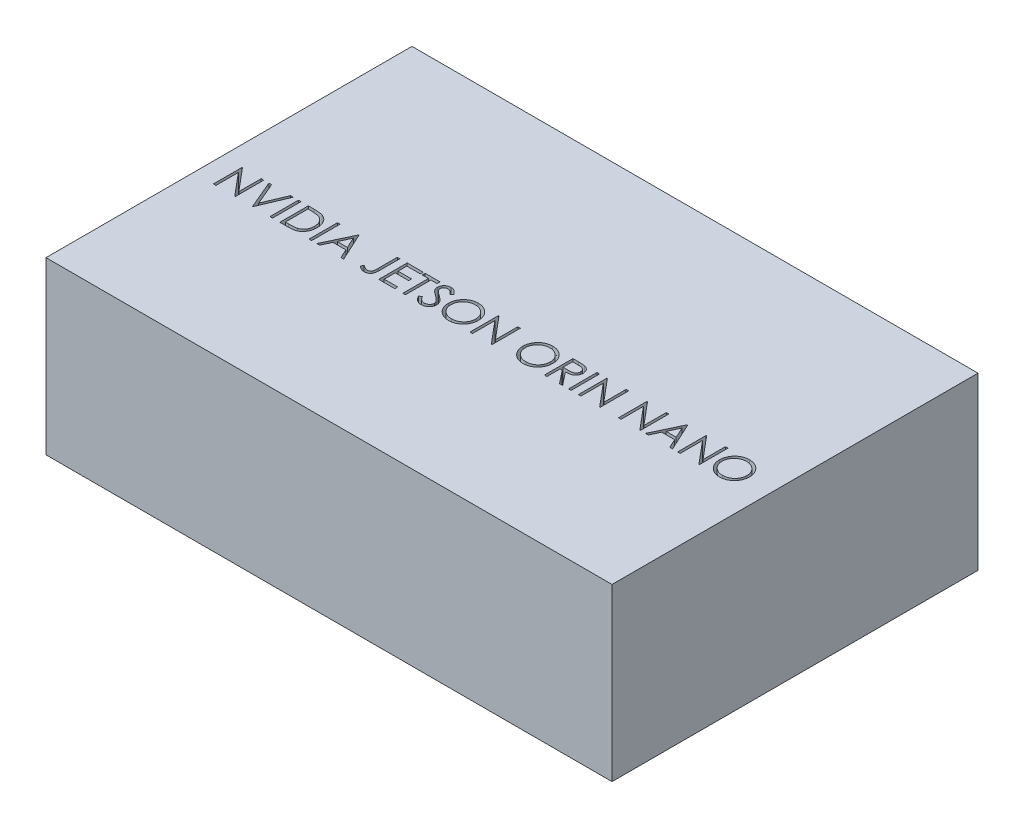
from build123d import *

# Parameters (mm, degrees)
SKETCH1_W           = 69.6
SKETCH1_H           = 45
BOSS_EXTRUDE1_DEPTH = 21
SKETCH2_W           = 0.314102564
SKETCH2_H           = 3.5
CUT_EXTRUDE1_DEPTH  = 10


with BuildPart() as part:
    # Sketch1 → Boss-Extrude1 (new body)
    with BuildSketch(Plane(origin=(0, 0, 0), x_dir=(1, 0, 0), z_dir=(0, 1, 0))):
        with Locations((34.8, 22.5)):
            Rectangle(SKETCH1_W, SKETCH1_H)
    extrude(amount=BOSS_EXTRUDE1_DEPTH)

    # Sketch2 → Cut-Extrude1 (cut)
    # profile 1 of 20: a face of its own
    with BuildSketch(Plane(origin=(0, 21, 0), x_dir=(1, 0, 0), z_dir=(0, 1, 0))):
        Polygon((2.444579456, 18.144195519), (2.444579456, 21.644195519), (2.510484905, 21.644195519), (4.822784584, 18.889487987), (4.822784584, 21.644195519), (5.136887148, 21.644195519), (5.136887148, 18.144195519), (5.065372725, 18.144195519), (2.75868202, 20.892592955), (2.75868202, 18.144195519), align=None)
    # profile 2 of 20: a face of its own
    with BuildSketch(Plane(origin=(0, 21, 0), x_dir=(1, 0, 0), z_dir=(0, 1, 0))):
        Polygon((5.765092276, 21.644195519), (6.101630738, 21.644195519), (7.268297405, 18.885982378), (8.434964071, 21.644195519), (8.771502533, 21.644195519), (7.290733302, 18.144195519), (7.245861507, 18.144195519), align=None)
    # profile 3 of 20: a face of its own
    with BuildSketch(Plane(origin=(0, 21, 0), x_dir=(1, 0, 0), z_dir=(0, 1, 0))):
        with Locations((9.556758943, 19.894195519)):
            Rectangle(SKETCH2_W, SKETCH2_H)
    # profile 4 of 20: a face of its own
    with BuildSketch(Plane(origin=(0, 21, 0), x_dir=(1, 0, 0), z_dir=(0, 1, 0))):
        with BuildLine():
            Line((10.611246123, 18.144195519), (10.611246123, 21.644195519))
            Line((10.611246123, 21.644195519), (11.317976892, 21.644195519))
            add(Edge.make_bspline(
                [(11.317976892, 21.644195519), (11.37944588, 21.643752949), (11.498203645, 21.642897906), (11.669816093, 21.637476515), (11.828599855, 21.627886049), (11.974032714, 21.613916523), (12.106513926, 21.59676349), (12.225672534, 21.575263085), (12.332124677, 21.549874915), (12.397594118, 21.528229465), (12.428553815, 21.517993596)],
                knots=[0, 0, 0, 0, 1.314313732, 2.53924729, 3.670748893, 4.714932338, 5.66265055, 6.526160246, 7.303039223, 8, 8, 8, 8], degree=3))
            add(Edge.make_bspline(
                [(12.428553815, 21.517993596), (12.469048554, 21.502562891), (12.549119746, 21.472051397), (12.663126869, 21.414495095), (12.770452232, 21.349281993), (12.871671377, 21.276326131), (12.964472203, 21.193561782), (13.0524801, 21.104504697), (13.132094824, 21.005916356), (13.20500312, 20.899841368), (13.270738779, 20.787529316), (13.327877937, 20.669194208), (13.37533193, 20.545436999), (13.414725157, 20.416601852), (13.445771615, 20.282405474), (13.466953546, 20.142691608), (13.480924536, 19.998012418), (13.482328587, 19.899837955), (13.483040994, 19.850024846)],
                knots=[0, 0, 0, 0, 0.984719456, 1.947108742, 2.898477687, 3.838006223, 4.779231079, 5.722358779, 6.681677486, 7.655904652, 8.64651281, 9.637519902, 10.640069247, 11.656948941, 12.698408672, 13.768548281, 14.867775369, 16, 16, 16, 16], degree=3))
            add(Edge.make_bspline(
                [(13.483040994, 19.850024846), (13.482412027, 19.806763608), (13.481172581, 19.721512819), (13.470043265, 19.595871923), (13.453866945, 19.473958352), (13.428822747, 19.356352652), (13.398420234, 19.242024434), (13.359456082, 19.13219219), (13.314820586, 19.02584838), (13.262770708, 18.924430904), (13.205629322, 18.828347532), (13.144307579, 18.737772004), (13.078870884, 18.653996782), (13.008695251, 18.57676817), (12.934687535, 18.506202592), (12.856363204, 18.441710576), (12.773520153, 18.384554021), (12.68652943, 18.332486913), (12.592853301, 18.287066558), (12.490717435, 18.248636548), (12.379686257, 18.216789933), (12.2600323, 18.190219037), (12.131548822, 18.169141734), (11.994109857, 18.155015342), (11.847926567, 18.145462409), (11.747547302, 18.144626016), (11.695881539, 18.144195519)],
                knots=[0, 0, 0, 0, 1.105936401, 2.179363191, 3.223086493, 4.248585256, 5.251745608, 6.245858792, 7.225916811, 8.198733463, 9.158002045, 10.082870192, 10.993790845, 11.873723703, 12.748670949, 13.606408763, 14.465103618, 15.319838547, 16.196477973, 17.123216899, 18.106603292, 19.147568657, 20.255746949, 21.433717677, 22.679120308, 24, 24, 24, 24], degree=3))
            Line((11.695881539, 18.144195519), (10.611246123, 18.144195519))
        make_face()
        with BuildLine():
            Line((10.925348687, 18.503169878), (11.327091475, 18.503169878))
            add(Edge.make_bspline(
                [(11.327091475, 18.503169878), (11.384819846, 18.503417975), (11.495852644, 18.503895155), (11.655510642, 18.508082358), (11.801390038, 18.514924296), (11.933511547, 18.524499373), (12.051800572, 18.537167989), (12.156504322, 18.551292891), (12.24727958, 18.568890342), (12.302209017, 18.584841301), (12.327592276, 18.592212346)],
                knots=[0, 0, 0, 0, 1.375205317, 2.645023457, 3.804390687, 4.853969522, 5.800190428, 6.637939096, 7.370582563, 8, 8, 8, 8], degree=3))
            add(Edge.make_bspline(
                [(12.327592276, 18.592212346), (12.359540638, 18.603463905), (12.422674277, 18.625698278), (12.513555362, 18.666255939), (12.598312366, 18.714298009), (12.678422392, 18.767700283), (12.752749047, 18.828346285), (12.822173164, 18.894917274), (12.886554965, 18.967752049), (12.945229273, 19.04676021), (12.997737577, 19.131450006), (13.043208806, 19.220988839), (13.083060338, 19.31439565), (13.114338931, 19.413104808), (13.138854515, 19.516233867), (13.156219203, 19.62379008), (13.167033927, 19.735753362), (13.168295375, 19.811905486), (13.16893843, 19.850725968)],
                knots=[0, 0, 0, 0, 0.998632004, 1.973411704, 2.929992603, 3.868527914, 4.809262121, 5.754881198, 6.702106254, 7.672490631, 8.653608572, 9.636854334, 10.631411391, 11.644891563, 12.686317036, 13.754757253, 14.855430412, 16, 16, 16, 16], degree=3))
            add(Edge.make_bspline(
                [(13.16893843, 19.850725968), (13.168425143, 19.891659448), (13.167416785, 19.972073633), (13.154742475, 20.090064328), (13.136220919, 20.203544979), (13.109437233, 20.312523174), (13.075306354, 20.417211526), (13.032711713, 20.517031036), (12.984045093, 20.613035905), (12.926141757, 20.703010271), (12.862726163, 20.78810338), (12.792348284, 20.866058296), (12.716126245, 20.937052596), (12.634891396, 21.002191909), (12.546354297, 21.058855584), (12.452600606, 21.109542266), (12.352254935, 21.152558157), (12.282442239, 21.17543702), (12.24696327, 21.187064109)],
                knots=[0, 0, 0, 0, 1.122418816, 2.205001699, 3.251619955, 4.274784885, 5.280384055, 6.268708349, 7.249350384, 8.229342522, 9.199999885, 10.157847722, 11.105861043, 12.055065948, 13.010012805, 13.98527497, 14.976112212, 16, 16, 16, 16], degree=3))
            add(Edge.make_bspline(
                [(12.24696327, 21.187064109), (12.217612124, 21.195180537), (12.155203533, 21.21243829), (12.053364069, 21.231263662), (11.93874892, 21.247868161), (11.810849219, 21.2619262), (11.66981076, 21.272013522), (11.515525072, 21.279584836), (11.347925467, 21.284691469), (11.231742933, 21.285040176), (11.171442437, 21.28522116)],
                knots=[0, 0, 0, 0, 0.674548936, 1.434276114, 2.292660221, 3.240891867, 4.284742987, 5.42552168, 6.663806718, 8, 8, 8, 8], degree=3))
            Line((11.171442437, 21.28522116), (10.925348687, 21.28522116))
            Line((10.925348687, 21.28522116), (10.925348687, 18.503169878))
        make_face(mode=Mode.SUBTRACT)
    # profile 5 of 20: a face of its own
    with BuildSketch(Plane(origin=(0, 21, 0), x_dir=(1, 0, 0), z_dir=(0, 1, 0))):
        with Locations((14.358040994, 19.894195519)):
            Rectangle(SKETCH2_W, SKETCH2_H)
    # profile 6 of 20: a face of its own
    with BuildSketch(Plane(origin=(0, 21, 0), x_dir=(1, 0, 0), z_dir=(0, 1, 0))):
        Polygon((16.84842561, 21.644195519), (18.463810225, 18.144195519), (18.122363911, 18.144195519), (17.604936026, 19.265990391), (16.018297405, 19.265990391), (15.486145962, 18.144195519), (15.143297405, 18.144195519), (16.803553815, 21.644195519), align=None)
        Polygon((16.822484103, 20.962004013), (16.188670001, 19.62496475), (17.439471283, 19.62496475), align=None, mode=Mode.SUBTRACT)
    # profile 7 of 20: a face of its own
    with BuildSketch(Plane(origin=(0, 21, 0), x_dir=(1, 0, 0), z_dir=(0, 1, 0))):
        with BuildLine():
            Line((21.559964071, 21.644195519), (21.874066635, 21.644195519))
            Line((21.874066635, 21.644195519), (21.874066635, 19.280713949))
            add(Edge.make_bspline(
                [(21.874066635, 19.280713949), (21.873752717, 19.237008778), (21.873149955, 19.153089517), (21.869835544, 19.032215621), (21.863702066, 18.921844935), (21.854767054, 18.821726488), (21.842846821, 18.732173932), (21.829205793, 18.652495315), (21.812692994, 18.583355632), (21.787826528, 18.505720276), (21.747052579, 18.420576472), (21.685685541, 18.328621321), (21.609452745, 18.24818791), (21.521151711, 18.178335186), (21.420010687, 18.122677954), (21.308112468, 18.082722776), (21.186145881, 18.058351919), (21.101546668, 18.055778014), (21.057960866, 18.05445193)],
                knots=[0, 0, 0, 0, 1.237770943, 2.376671248, 3.424123796, 4.367912054, 5.222547132, 5.982086412, 6.656319012, 7.234008312, 8.288027371, 9.317870876, 10.352700517, 11.413286737, 12.494591526, 13.606319346, 14.766767577, 16, 16, 16, 16], degree=3))
            add(Edge.make_bspline(
                [(21.057960866, 18.05445193), (21.024002508, 18.055532539), (20.955676042, 18.057706796), (20.853985333, 18.075428509), (20.752583357, 18.102744552), (20.650931908, 18.142747148), (20.547022667, 18.197152746), (20.43944832, 18.268337563), (20.326825129, 18.356169089), (20.252641843, 18.423206835), (20.213810225, 18.458298083)],
                knots=[0, 0, 0, 0, 0.848567217, 1.707373443, 2.573483905, 3.470863513, 4.432650262, 5.500696352, 6.691726801, 8, 8, 8, 8], degree=3))
            Line((20.213810225, 18.458298083), (20.398906379, 18.727528853))
            add(Edge.make_bspline(
                [(20.398906379, 18.727528853), (20.441609058, 18.698081456), (20.522237284, 18.642480933), (20.640741725, 18.570954332), (20.745738878, 18.509629167), (20.814421825, 18.478376888), (20.846222084, 18.463907058)],
                knots=[0, 0, 0, 0, 1.196737151, 2.259595785, 3.194191475, 4, 4, 4, 4], degree=3))
            add(Edge.make_bspline(
                [(20.846222084, 18.463907058), (20.865506396, 18.4563476), (20.903327225, 18.441521821), (20.961152305, 18.424975923), (21.018647341, 18.415933513), (21.056765035, 18.41425218), (21.075488911, 18.413426289)],
                knots=[0, 0, 0, 0, 1.051806502, 2.062826769, 3.048436908, 4, 4, 4, 4], degree=3))
            add(Edge.make_bspline(
                [(21.075488911, 18.413426289), (21.099671699, 18.414449024), (21.147472156, 18.416470593), (21.21693615, 18.434319869), (21.283394181, 18.461564272), (21.344463839, 18.501455565), (21.400749226, 18.548886986), (21.447192051, 18.606242995), (21.485909296, 18.669808979), (21.509208989, 18.729980433), (21.524053761, 18.784857063), (21.533475388, 18.835290199), (21.541714048, 18.894251677), (21.5488956, 18.961811878), (21.553100071, 19.03810606), (21.557817344, 19.122910203), (21.559522605, 19.216438115), (21.559812425, 19.281649067), (21.559964071, 19.315770039)],
                knots=[0, 0, 0, 0, 0.997221856, 1.971139923, 2.944579524, 3.951425367, 4.971190333, 5.972282193, 6.985401279, 8.033996657, 8.624075553, 9.332086008, 10.151144245, 11.082816738, 12.137127781, 13.306538797, 14.590673636, 16, 16, 16, 16], degree=3))
            Line((21.559964071, 19.315770039), (21.559964071, 21.644195519))
        make_face()
    # profile 8 of 20: a face of its own
    with BuildSketch(Plane(origin=(0, 21, 0), x_dir=(1, 0, 0), z_dir=(0, 1, 0))):
        Polygon((22.771502533, 21.644195519), (24.745861507, 21.644195519), (24.745861507, 21.28522116), (23.085605097, 21.28522116), (23.085605097, 20.208298083), (24.745861507, 20.208298083), (24.745861507, 19.849323724), (23.085605097, 19.849323724), (23.085605097, 18.503169878), (24.745861507, 18.503169878), (24.745861507, 18.144195519), (22.771502533, 18.144195519), align=None)
    # profile 9 of 20: a face of its own
    with BuildSketch(Plane(origin=(0, 21, 0), x_dir=(1, 0, 0), z_dir=(0, 1, 0))):
        Polygon((24.970220481, 21.28522116), (24.970220481, 21.644195519), (26.809964071, 21.644195519), (26.809964071, 21.28522116), (26.047143558, 21.28522116), (26.047143558, 18.144195519), (25.733040994, 18.144195519), (25.733040994, 21.28522116), align=None)
    # profile 10 of 20: a face of its own
    with BuildSketch(Plane(origin=(0, 21, 0), x_dir=(1, 0, 0), z_dir=(0, 1, 0))):
        with BuildLine():
            Line((26.989451251, 18.819375808), (27.285324648, 18.996759622))
            add(Edge.make_bspline(
                [(27.285324648, 18.996759622), (27.312842885, 18.950695237), (27.365566766, 18.862437653), (27.453518125, 18.743179613), (27.544651036, 18.641817456), (27.63964037, 18.558940848), (27.737906318, 18.493691962), (27.840090372, 18.44748973), (27.945848182, 18.418673754), (28.017822004, 18.415173668), (28.053754135, 18.413426289)],
                knots=[0, 0, 0, 0, 1.272034388, 2.437168799, 3.508375237, 4.49857839, 5.41946034, 6.295179144, 7.148887113, 8, 8, 8, 8], degree=3))
            add(Edge.make_bspline(
                [(28.053754135, 18.413426289), (28.084440996, 18.414280961), (28.145277769, 18.415975351), (28.234840012, 18.432256153), (28.321821814, 18.457268282), (28.404430452, 18.493089214), (28.481526066, 18.5364277), (28.549132762, 18.588773877), (28.607578875, 18.647380083), (28.655387989, 18.712762737), (28.692068025, 18.783079886), (28.720260093, 18.855255837), (28.735905167, 18.930424406), (28.73826192, 18.981034868), (28.739451251, 19.006575327)],
                knots=[0, 0, 0, 0, 1.095163259, 2.171163733, 3.241058638, 4.321873601, 5.38011039, 6.391990106, 7.366004449, 8.327778327, 9.272591725, 10.192022065, 11.087607919, 12, 12, 12, 12], degree=3))
            add(Edge.make_bspline(
                [(28.739451251, 19.006575327), (28.73797694, 19.035716177), (28.734979882, 19.094955266), (28.709648402, 19.182354919), (28.669799155, 19.268847489), (28.633036511, 19.322348754), (28.613950449, 19.350125007)],
                knots=[0, 0, 0, 0, 0.938893495, 1.908633276, 2.914225137, 4, 4, 4, 4], degree=3))
            add(Edge.make_bspline(
                [(28.613950449, 19.350125007), (28.598279835, 19.37017183), (28.565381341, 19.412257629), (28.508823828, 19.474902864), (28.442457714, 19.539521283), (28.368554159, 19.60858034), (28.28442107, 19.678868137), (28.192693556, 19.753736415), (28.091029697, 19.830337992), (28.0197302, 19.881710557), (27.982940834, 19.908217955)],
                knots=[0, 0, 0, 0, 0.722233717, 1.516239348, 2.393582979, 3.351407094, 4.387010283, 5.505090956, 6.712668013, 8, 8, 8, 8], degree=3))
            add(Edge.make_bspline(
                [(27.982940834, 19.908217955), (27.946116838, 19.934446543), (27.875712161, 19.984593605), (27.777253579, 20.059017889), (27.689209116, 20.127061759), (27.611970099, 20.189365771), (27.545570503, 20.245938375), (27.489487092, 20.296236315), (27.445148534, 20.341619876), (27.420492954, 20.371061217), (27.409423206, 20.384279654)],
                knots=[0, 0, 0, 0, 1.452282411, 2.77665338, 3.964542531, 5.026858415, 5.96415736, 6.766646006, 7.446254459, 8, 8, 8, 8], degree=3))
            add(Edge.make_bspline(
                [(27.409423206, 20.384279654), (27.393950661, 20.404880691), (27.363521824, 20.445395395), (27.323355818, 20.508720252), (27.289216656, 20.573543518), (27.262454324, 20.640039382), (27.239918105, 20.707274311), (27.224760174, 20.776125557), (27.215268777, 20.846284175), (27.21429679, 20.893497676), (27.213810225, 20.917132218)],
                knots=[0, 0, 0, 0, 1.068054152, 2.10047183, 3.106115577, 4.101338837, 5.06977816, 6.043150881, 7.020423561, 8, 8, 8, 8], degree=3))
            add(Edge.make_bspline(
                [(27.213810225, 20.917132218), (27.215115434, 20.954161993), (27.217697954, 21.027430056), (27.239538471, 21.134460887), (27.274011365, 21.236647304), (27.322306253, 21.332977638), (27.384563606, 21.420943619), (27.45660958, 21.501557106), (27.542421066, 21.569325688), (27.63657369, 21.628537746), (27.739630062, 21.674883671), (27.847620965, 21.709844652), (27.960718037, 21.729653909), (28.037321172, 21.732496674), (28.076190033, 21.733939109)],
                knots=[0, 0, 0, 0, 1.005424448, 1.989358655, 2.955360095, 3.929531133, 4.905563448, 5.876582895, 6.856512386, 7.866279853, 8.892233794, 9.918561126, 10.94386622, 12, 12, 12, 12], degree=3))
            add(Edge.make_bspline(
                [(28.076190033, 21.733939109), (28.117434133, 21.732516557), (28.199455485, 21.729687556), (28.3201047, 21.705090025), (28.436265417, 21.664389353), (28.529708682, 21.618200695), (28.602841443, 21.57206928), (28.658614176, 21.530049455), (28.715131627, 21.481674347), (28.772849681, 21.426815101), (28.830790341, 21.36496835), (28.889813793, 21.296557661), (28.950058062, 21.222001105), (28.988813922, 21.168776604), (29.00868202, 21.141491192)],
                knots=[0, 0, 0, 0, 1.286793592, 2.559021753, 3.825965368, 5.121522368, 5.803751409, 6.523245864, 7.299691795, 8.125521123, 9.008227632, 9.944561021, 10.946284179, 12, 12, 12, 12], degree=3))
            Line((29.00868202, 21.141491192), (28.724727693, 20.926246801))
            add(Edge.make_bspline(
                [(28.724727693, 20.926246801), (28.707581761, 20.948335492), (28.674562703, 20.990873145), (28.624433217, 21.050444461), (28.577184569, 21.10486094), (28.530634169, 21.152126068), (28.487240537, 21.194828202), (28.445123495, 21.231387958), (28.404889144, 21.262163554), (28.354172233, 21.295007114), (28.290454515, 21.327563617), (28.210469979, 21.355112695), (28.126883704, 21.371667757), (28.069954072, 21.373856645), (28.041133943, 21.37496475)],
                knots=[0, 0, 0, 0, 1.181633172, 2.275549214, 3.290209073, 4.226197932, 5.078386478, 5.862611352, 6.581680152, 7.217281963, 8.414376989, 9.595101626, 10.782541182, 12, 12, 12, 12], degree=3))
            add(Edge.make_bspline(
                [(28.041133943, 21.37496475), (28.004977421, 21.37375305), (27.935252973, 21.371416401), (27.836262737, 21.345896416), (27.747168812, 21.305714555), (27.670616247, 21.249399577), (27.60687927, 21.182678585), (27.560773811, 21.10589973), (27.533023647, 21.021117327), (27.529637367, 20.961975671), (27.527912789, 20.931855776)],
                knots=[0, 0, 0, 0, 1.14458467, 2.207223713, 3.21896685, 4.227309161, 5.202851033, 6.127160689, 7.046193047, 8, 8, 8, 8], degree=3))
            add(Edge.make_bspline(
                [(27.527912789, 20.931855776), (27.528305916, 20.913104297), (27.529092812, 20.875570678), (27.54006761, 20.820119256), (27.554166939, 20.764807916), (27.57650957, 20.709885334), (27.607354874, 20.654390975), (27.64786005, 20.597369237), (27.698873362, 20.538317528), (27.737950374, 20.499910155), (27.75858186, 20.479632218)],
                knots=[0, 0, 0, 0, 0.858281714, 1.717966888, 2.583508476, 3.4729293, 4.427298488, 5.488583878, 6.674047936, 8, 8, 8, 8], degree=3))
            add(Edge.make_bspline(
                [(27.75858186, 20.479632218), (27.766243232, 20.472795192), (27.784444899, 20.456551984), (27.817720825, 20.429959703), (27.861663623, 20.397156931), (27.915125824, 20.356569615), (27.979093186, 20.309488152), (28.053572742, 20.25651454), (28.137734275, 20.195929081), (28.197456191, 20.153571541), (28.229034584, 20.131174686)],
                knots=[0, 0, 0, 0, 0.420754252, 0.999615792, 1.744751191, 2.668019286, 3.750313428, 4.999500688, 6.413464383, 8, 8, 8, 8], degree=3))
            add(Edge.make_bspline(
                [(28.229034584, 20.131174686), (28.267020497, 20.103533326), (28.340574954, 20.050009665), (28.445232534, 19.969593985), (28.540126342, 19.890946216), (28.625589545, 19.814568609), (28.702466454, 19.741040516), (28.769904174, 19.669477336), (28.828589855, 19.600391763), (28.891769073, 19.511819187), (28.956326893, 19.403038103), (29.0117684, 19.269759864), (29.046726748, 19.135963544), (29.051298263, 19.046036708), (29.053553815, 19.001667474)],
                knots=[0, 0, 0, 0, 1.163667725, 2.253281268, 3.268753668, 4.215851969, 5.092017293, 5.902905408, 6.650798638, 7.335211899, 8.59617414, 9.77448103, 10.901945474, 12, 12, 12, 12], degree=3))
            add(Edge.make_bspline(
                [(29.053553815, 19.001667474), (29.052896677, 18.970289109), (29.051595162, 18.908141726), (29.036634248, 18.816886649), (29.014714583, 18.728255779), (28.981677349, 18.643344667), (28.94135419, 18.560599904), (28.890187943, 18.482192004), (28.830880258, 18.406385605), (28.762846493, 18.335202114), (28.688400591, 18.269855918), (28.609716896, 18.211726856), (28.526666623, 18.163258533), (28.439700306, 18.123707691), (28.34879797, 18.092774173), (28.253990186, 18.070361304), (28.155120675, 18.056605593), (28.087920193, 18.055177832), (28.053754135, 18.05445193)],
                knots=[0, 0, 0, 0, 0.983748083, 1.948392443, 2.894712957, 3.844097841, 4.80183111, 5.778335162, 6.776009319, 7.81870978, 8.863265674, 9.881300176, 10.883814829, 11.87499822, 12.874611388, 13.892143829, 14.928324115, 16, 16, 16, 16], degree=3))
            add(Edge.make_bspline(
                [(28.053754135, 18.05445193), (28.027318792, 18.054963111), (27.974781032, 18.055979037), (27.89707155, 18.064960317), (27.820931961, 18.077667421), (27.747317679, 18.097841491), (27.675280268, 18.122318468), (27.605133033, 18.1524568), (27.536841979, 18.188574002), (27.470024396, 18.229869026), (27.404850222, 18.277926771), (27.341930754, 18.333900267), (27.279201568, 18.396245772), (27.218514172, 18.466656336), (27.158641028, 18.543994419), (27.100762618, 18.628983602), (27.0436809, 18.721160956), (27.007865433, 18.786026041), (26.989451251, 18.819375808)],
                knots=[0, 0, 0, 0, 0.915332311, 1.819136955, 2.706846663, 3.586547465, 4.459518054, 5.340707479, 6.227863349, 7.133153174, 8.059268498, 9.028702269, 10.047606654, 11.120612155, 12.245963614, 13.433783089, 14.680604001, 16, 16, 16, 16], degree=3))
        make_face()
    # profile 11 of 20: a face of its own
    with BuildSketch(Plane(origin=(0, 21, 0), x_dir=(1, 0, 0), z_dir=(0, 1, 0))):
        with BuildLine():
            add(Edge.make_bspline(
                [(31.409323046, 21.733939109), (31.474131151, 21.73229763), (31.601419618, 21.729073629), (31.788494516, 21.704394525), (31.967089611, 21.661699135), (32.13865975, 21.604836153), (32.301152727, 21.528981767), (32.455791619, 21.437296619), (32.602208493, 21.32882016), (32.738429875, 21.204390933), (32.863086825, 21.06900748), (32.972912711, 20.924529569), (33.064955005, 20.771830767), (33.140540792, 20.611369937), (33.199839402, 20.443509969), (33.240758446, 20.267355966), (33.266896596, 20.084049276), (33.269952373, 19.959022411), (33.271502533, 19.895597763)],
                knots=[0, 0, 0, 0, 1.065120563, 2.091984664, 3.0946048, 4.079830382, 5.057816894, 6.036188127, 7.030412546, 8.04752943, 9.064399622, 10.05169764, 11.02544977, 11.989514704, 12.962713494, 13.945757189, 14.957906945, 16, 16, 16, 16], degree=3))
            add(Edge.make_bspline(
                [(33.271502533, 19.895597763), (33.2699526, 19.832640317), (33.266897504, 19.708543896), (33.240728726, 19.526400452), (33.199687726, 19.351309755), (33.14109146, 19.183564103), (33.065865982, 19.022986539), (32.97321081, 18.869999585), (32.8640696, 18.724553087), (32.739862749, 18.588240421), (32.604461707, 18.463242951), (32.45923144, 18.354324075), (32.30743812, 18.26059995), (32.147128412, 18.185816277), (31.980428375, 18.126044356), (31.805846052, 18.085291726), (31.624199498, 18.059004683), (31.500328494, 18.055986167), (31.437367917, 18.05445193)],
                knots=[0, 0, 0, 0, 1.043624062, 2.057103931, 3.04512605, 4.022047818, 4.998200453, 5.980619268, 6.982898556, 8.009068085, 9.034988726, 10.034168286, 11.015286542, 11.987931943, 12.962482838, 13.94673481, 14.956375938, 16, 16, 16, 16], degree=3))
            add(Edge.make_bspline(
                [(31.437367917, 18.05445193), (31.373943598, 18.056001316), (31.248917382, 18.05905557), (31.065380347, 18.085236975), (30.889102603, 18.126178279), (30.720588252, 18.184687715), (30.559743322, 18.260304946), (30.40625324, 18.352509325), (30.260734092, 18.461916466), (30.124392346, 18.586083041), (29.999643148, 18.721254593), (29.890883772, 18.866088848), (29.798658659, 19.017744304), (29.723295326, 19.176641829), (29.663630867, 19.342013271), (29.622926049, 19.514961749), (29.596590097, 19.694501255), (29.59355525, 19.816744153), (29.592015353, 19.87877084)],
                knots=[0, 0, 0, 0, 1.053102029, 2.075944431, 3.073151272, 4.055350789, 5.033113405, 6.020478099, 7.024410459, 8.052272461, 9.079885166, 10.07527673, 11.055994387, 12.023226415, 12.992069828, 13.970394897, 14.97016774, 16, 16, 16, 16], degree=3))
            add(Edge.make_bspline(
                [(29.592015353, 19.87877084), (29.592549989, 19.920403509), (29.593612515, 20.003143633), (29.606404208, 20.126010233), (29.624965909, 20.24690089), (29.651567821, 20.365471838), (29.686359488, 20.481432823), (29.727411516, 20.595583586), (29.777551361, 20.70676731), (29.834232009, 20.815510701), (29.897493817, 20.920118607), (29.967369567, 21.01899819), (30.041404935, 21.112979187), (30.122568329, 21.199626191), (30.208184774, 21.281459847), (30.299643152, 21.357222564), (30.396385396, 21.427597515), (30.498827776, 21.491017856), (30.604446051, 21.548376991), (30.713322829, 21.597598842), (30.8239794, 21.639844904), (30.936934048, 21.674085729), (31.05188682, 21.701117765), (31.169088605, 21.719525118), (31.288446031, 21.732349436), (31.36885735, 21.733406938), (31.409323046, 21.733939109)],
                knots=[0, 0, 0, 0, 1.037015668, 2.060948919, 3.074880161, 4.083647147, 5.086022904, 6.090072063, 7.104153813, 8.122640571, 9.144368836, 10.147691507, 11.138137339, 12.123020368, 13.103399296, 14.087645067, 15.080126199, 16.082011238, 17.087798457, 18.072939717, 19.057185487, 20.037253025, 21.01195951, 21.997135196, 22.992090687, 24, 24, 24, 24], degree=3))
        make_face()
        with BuildLine():
            add(Edge.make_bspline(
                [(31.424747725, 21.37496475), (31.391533092, 21.37455986), (31.325421359, 21.37375395), (31.227136822, 21.363138235), (31.130144889, 21.348008346), (31.034425526, 21.326426825), (30.940379237, 21.297022772), (30.847129396, 21.263181864), (30.755526342, 21.221960773), (30.665872484, 21.175388069), (30.578957409, 21.123839148), (30.496944707, 21.066867381), (30.419622064, 21.005808827), (30.347178797, 20.940520989), (30.279827625, 20.870671388), (30.216242923, 20.797318952), (30.158973342, 20.71836706), (30.106487765, 20.635956654), (30.059519924, 20.550195072), (30.01775457, 20.46198521), (29.983590561, 20.370607523), (29.955728185, 20.277053366), (29.932628374, 20.181470906), (29.91799445, 20.083135057), (29.90726209, 19.982539945), (29.906502245, 19.914558091), (29.906117917, 19.880173083)],
                knots=[0, 0, 0, 0, 1.008559885, 2.007477868, 2.99961109, 3.989939068, 4.984837346, 5.991145699, 7.001802488, 8.033829008, 9.059044045, 10.069351652, 11.065060232, 12.050310815, 13.029377138, 14.011219647, 14.996725999, 15.989392538, 16.977580475, 17.965360261, 18.951710183, 19.937753436, 20.929683414, 21.935841486, 22.955955122, 24, 24, 24, 24], degree=3))
            add(Edge.make_bspline(
                [(29.906117917, 19.880173083), (29.907392779, 19.829610863), (29.909900827, 19.730139332), (29.931858397, 19.584371189), (29.965680372, 19.444282902), (30.015537738, 19.310640993), (30.077888353, 19.18229671), (30.154915243, 19.060388605), (30.246174329, 18.944883731), (30.349837855, 18.836588462), (30.463160562, 18.737742658), (30.583493292, 18.650979249), (30.709546899, 18.577568999), (30.841650102, 18.517763927), (30.979097641, 18.470374189), (31.122775192, 18.437895558), (31.271725652, 18.416520103), (31.373256307, 18.414467347), (31.424747725, 18.413426289)],
                knots=[0, 0, 0, 0, 1.032063989, 2.030389145, 3.003944642, 3.970395727, 4.937377036, 5.913328081, 6.909231446, 7.93887556, 8.970685674, 9.976071282, 10.964166581, 11.944589148, 12.933237628, 13.927779006, 14.949070134, 16, 16, 16, 16], degree=3))
            add(Edge.make_bspline(
                [(31.424747725, 18.413426289), (31.459357227, 18.413901793), (31.527998263, 18.414844861), (31.630093785, 18.424343538), (31.730349997, 18.439575407), (31.828626277, 18.461506063), (31.924811088, 18.488953269), (32.019305892, 18.521560997), (32.111104182, 18.562242201), (32.20136402, 18.607190152), (32.287760261, 18.65843031), (32.370235794, 18.71346846), (32.446711773, 18.77443708), (32.519100845, 18.838754893), (32.586728534, 18.907718741), (32.649137518, 18.981238963), (32.70611765, 19.05977962), (32.758583297, 19.142065026), (32.80538656, 19.228061278), (32.846165659, 19.316590956), (32.880761775, 19.407436066), (32.908690279, 19.500727637), (32.930575741, 19.596288486), (32.945655661, 19.694246564), (32.9562041, 19.794405906), (32.956999177, 19.862149762), (32.957399969, 19.896298885)],
                knots=[0, 0, 0, 0, 1.047197238, 2.076906641, 3.100256066, 4.114471768, 5.12198147, 6.126382909, 7.136867548, 8.15857795, 9.17633901, 10.174870724, 11.156907918, 12.133735059, 13.104061851, 14.077631395, 15.04955518, 16.038496417, 17.029181396, 18.010275684, 18.986308667, 19.968651475, 20.955262928, 21.950658345, 22.966943676, 24, 24, 24, 24], degree=3))
            add(Edge.make_bspline(
                [(32.957399969, 19.896298885), (32.956998856, 19.930214389), (32.956203174, 19.997492039), (32.9456607, 20.096952858), (32.930559809, 20.194206069), (32.908797101, 20.288869872), (32.880746947, 20.380968397), (32.846159617, 20.470415145), (32.805374318, 20.55754334), (32.758566093, 20.642137637), (32.70595027, 20.723312375), (32.648456026, 20.800914787), (32.585090678, 20.873487529), (32.517664653, 20.942822223), (32.444493768, 21.007440112), (32.365909474, 21.067362633), (32.282865796, 21.124035907), (32.194938561, 21.175161469), (32.104194607, 21.222375702), (32.011080649, 21.262826705), (31.916651549, 21.297198824), (31.821147437, 21.326515789), (31.723764459, 21.34792382), (31.62516063, 21.363151869), (31.525472371, 21.373750255), (31.458429152, 21.374558634), (31.424747725, 21.37496475)],
                knots=[0, 0, 0, 0, 1.02996197, 2.043119294, 3.035359645, 4.018872909, 4.991431989, 5.957985074, 6.929999688, 7.912076566, 8.892894881, 9.867085534, 10.843653904, 11.817741046, 12.803660682, 13.806313499, 14.818574707, 15.856120519, 16.894564902, 17.924820532, 18.937903209, 19.946497019, 20.957711757, 21.963978472, 22.977135795, 24, 24, 24, 24], degree=3))
        make_face(mode=Mode.SUBTRACT)
    # profile 12 of 20: a face of its own
    with BuildSketch(Plane(origin=(0, 21, 0), x_dir=(1, 0, 0), z_dir=(0, 1, 0))):
        Polygon((33.989451251, 18.144195519), (33.989451251, 21.644195519), (34.055356699, 21.644195519), (36.367656379, 18.889487987), (36.367656379, 21.644195519), (36.681758943, 21.644195519), (36.681758943, 18.144195519), (36.61024452, 18.144195519), (34.303553815, 20.892592955), (34.303553815, 18.144195519), align=None)
    # profile 13 of 20: a face of its own
    with BuildSketch(Plane(origin=(0, 21, 0), x_dir=(1, 0, 0), z_dir=(0, 1, 0))):
        with BuildLine():
            add(Edge.make_bspline(
                [(40.563169199, 21.733939109), (40.627977305, 21.73229763), (40.755265772, 21.729073629), (40.94234067, 21.704394525), (41.120935765, 21.661699135), (41.292505904, 21.604836153), (41.454998881, 21.528981767), (41.609637773, 21.437296619), (41.756054647, 21.32882016), (41.892276029, 21.204390933), (42.016932979, 21.06900748), (42.126758865, 20.924529569), (42.218801159, 20.771830767), (42.294386946, 20.611369937), (42.353685556, 20.443509969), (42.394604599, 20.267355966), (42.42074275, 20.084049276), (42.423798527, 19.959022411), (42.425348687, 19.895597763)],
                knots=[0, 0, 0, 0, 1.065120563, 2.091984664, 3.0946048, 4.079830382, 5.057816894, 6.036188127, 7.030412546, 8.04752943, 9.064399622, 10.05169764, 11.02544977, 11.989514704, 12.962713494, 13.945757189, 14.957906945, 16, 16, 16, 16], degree=3))
            add(Edge.make_bspline(
                [(42.425348687, 19.895597763), (42.423798754, 19.832640317), (42.420743658, 19.708543896), (42.39457488, 19.526400452), (42.35353388, 19.351309755), (42.294937614, 19.183564103), (42.219712135, 19.022986539), (42.127056964, 18.869999585), (42.017915753, 18.724553087), (41.893708902, 18.588240421), (41.75830786, 18.463242951), (41.613077594, 18.354324075), (41.461284274, 18.26059995), (41.300974566, 18.185816277), (41.134274529, 18.126044356), (40.959692206, 18.085291726), (40.778045652, 18.059004683), (40.654174648, 18.055986167), (40.591214071, 18.05445193)],
                knots=[0, 0, 0, 0, 1.043624062, 2.057103931, 3.04512605, 4.022047818, 4.998200453, 5.980619268, 6.982898556, 8.009068085, 9.034988726, 10.034168286, 11.015286542, 11.987931943, 12.962482838, 13.94673481, 14.956375938, 16, 16, 16, 16], degree=3))
            add(Edge.make_bspline(
                [(40.591214071, 18.05445193), (40.527789752, 18.056001316), (40.402763536, 18.05905557), (40.219226501, 18.085236975), (40.042948757, 18.126178279), (39.874434406, 18.184687715), (39.713589476, 18.260304946), (39.560099394, 18.352509325), (39.414580246, 18.461916466), (39.2782385, 18.586083041), (39.153489302, 18.721254593), (39.044729926, 18.866088848), (38.952504813, 19.017744304), (38.87714148, 19.176641829), (38.817477021, 19.342013271), (38.776772203, 19.514961749), (38.750436251, 19.694501255), (38.747401404, 19.816744153), (38.745861507, 19.87877084)],
                knots=[0, 0, 0, 0, 1.053102029, 2.075944431, 3.073151272, 4.055350789, 5.033113405, 6.020478099, 7.024410459, 8.052272461, 9.079885166, 10.07527673, 11.055994387, 12.023226415, 12.992069828, 13.970394897, 14.97016774, 16, 16, 16, 16], degree=3))
            add(Edge.make_bspline(
                [(38.745861507, 19.87877084), (38.746396143, 19.920403509), (38.747458669, 20.003143633), (38.760250361, 20.126010233), (38.778812063, 20.24690089), (38.805413975, 20.365471838), (38.840205642, 20.481432823), (38.88125767, 20.595583586), (38.931397515, 20.70676731), (38.988078163, 20.815510701), (39.051339971, 20.920118607), (39.12121572, 21.01899819), (39.195251089, 21.112979187), (39.276414483, 21.199626191), (39.362030928, 21.281459847), (39.453489306, 21.357222564), (39.55023155, 21.427597515), (39.65267393, 21.491017856), (39.758292205, 21.548376991), (39.867168983, 21.597598842), (39.977825554, 21.639844904), (40.090780202, 21.674085729), (40.205732974, 21.701117765), (40.322934759, 21.719525118), (40.442292185, 21.732349436), (40.522703504, 21.733406938), (40.563169199, 21.733939109)],
                knots=[0, 0, 0, 0, 1.037015668, 2.060948919, 3.074880161, 4.083647147, 5.086022904, 6.090072063, 7.104153813, 8.122640571, 9.144368836, 10.147691507, 11.138137339, 12.123020368, 13.103399296, 14.087645067, 15.080126199, 16.082011238, 17.087798457, 18.072939717, 19.057185487, 20.037253025, 21.01195951, 21.997135196, 22.992090687, 24, 24, 24, 24], degree=3))
        make_face()
        with BuildLine():
            add(Edge.make_bspline(
                [(40.578593879, 21.37496475), (40.545379245, 21.37455986), (40.479267512, 21.37375395), (40.380982976, 21.363138235), (40.283991042, 21.348008346), (40.18827168, 21.326426825), (40.094225391, 21.297022772), (40.00097555, 21.263181864), (39.909372496, 21.221960773), (39.819718638, 21.175388069), (39.732803563, 21.123839148), (39.650790861, 21.066867381), (39.573468217, 21.005808827), (39.501024951, 20.940520989), (39.433673779, 20.870671388), (39.370089077, 20.797318952), (39.312819495, 20.71836706), (39.260333919, 20.635956654), (39.213366078, 20.550195072), (39.171600724, 20.46198521), (39.137436715, 20.370607523), (39.109574339, 20.277053366), (39.086474528, 20.181470906), (39.071840604, 20.083135057), (39.061108244, 19.982539945), (39.060348399, 19.914558091), (39.059964071, 19.880173083)],
                knots=[0, 0, 0, 0, 1.008559885, 2.007477868, 2.99961109, 3.989939068, 4.984837346, 5.991145699, 7.001802488, 8.033829008, 9.059044045, 10.069351652, 11.065060232, 12.050310815, 13.029377138, 14.011219647, 14.996725999, 15.989392538, 16.977580475, 17.965360261, 18.951710183, 19.937753436, 20.929683414, 21.935841486, 22.955955122, 24, 24, 24, 24], degree=3))
            add(Edge.make_bspline(
                [(39.059964071, 19.880173083), (39.061238933, 19.829610863), (39.063746981, 19.730139332), (39.085704551, 19.584371189), (39.119526526, 19.444282902), (39.169383892, 19.310640993), (39.231734507, 19.18229671), (39.308761397, 19.060388605), (39.400020483, 18.944883731), (39.503684009, 18.836588462), (39.617006716, 18.737742658), (39.737339446, 18.650979249), (39.863393053, 18.577568999), (39.995496256, 18.517763927), (40.132943795, 18.470374189), (40.276621346, 18.437895558), (40.425571806, 18.416520103), (40.527102461, 18.414467347), (40.578593879, 18.413426289)],
                knots=[0, 0, 0, 0, 1.032063989, 2.030389145, 3.003944642, 3.970395727, 4.937377036, 5.913328081, 6.909231446, 7.93887556, 8.970685674, 9.976071282, 10.964166581, 11.944589148, 12.933237628, 13.927779006, 14.949070134, 16, 16, 16, 16], degree=3))
            add(Edge.make_bspline(
                [(40.578593879, 18.413426289), (40.613203381, 18.413901793), (40.681844417, 18.414844861), (40.783939939, 18.424343538), (40.884196151, 18.439575407), (40.982472431, 18.461506063), (41.078657242, 18.488953269), (41.173152045, 18.521560997), (41.264950336, 18.562242201), (41.355210173, 18.607190152), (41.441606415, 18.65843031), (41.524081947, 18.71346846), (41.600557927, 18.77443708), (41.672946999, 18.838754893), (41.740574688, 18.907718741), (41.802983672, 18.981238963), (41.859963804, 19.05977962), (41.912429451, 19.142065026), (41.959232713, 19.228061278), (42.000011813, 19.316590956), (42.034607928, 19.407436066), (42.062536433, 19.500727637), (42.084421895, 19.596288486), (42.099501815, 19.694246564), (42.110050253, 19.794405906), (42.110845331, 19.862149762), (42.111246123, 19.896298885)],
                knots=[0, 0, 0, 0, 1.047197238, 2.076906641, 3.100256066, 4.114471768, 5.12198147, 6.126382909, 7.136867548, 8.15857795, 9.17633901, 10.174870724, 11.156907918, 12.133735059, 13.104061851, 14.077631395, 15.04955518, 16.038496417, 17.029181396, 18.010275684, 18.986308667, 19.968651475, 20.955262928, 21.950658345, 22.966943676, 24, 24, 24, 24], degree=3))
            add(Edge.make_bspline(
                [(42.111246123, 19.896298885), (42.11084501, 19.930214389), (42.110049328, 19.997492039), (42.099506853, 20.096952858), (42.084405963, 20.194206069), (42.062643255, 20.288869872), (42.034593101, 20.380968397), (42.000005771, 20.470415145), (41.959220471, 20.55754334), (41.912412247, 20.642137637), (41.859796424, 20.723312375), (41.80230218, 20.800914787), (41.738936832, 20.873487529), (41.671510807, 20.942822223), (41.598339922, 21.007440112), (41.519755628, 21.067362633), (41.43671195, 21.124035907), (41.348784715, 21.175161469), (41.258040761, 21.222375702), (41.164926803, 21.262826705), (41.070497703, 21.297198824), (40.974993591, 21.326515789), (40.877610613, 21.34792382), (40.779006784, 21.363151869), (40.679318525, 21.373750255), (40.612275306, 21.374558634), (40.578593879, 21.37496475)],
                knots=[0, 0, 0, 0, 1.02996197, 2.043119294, 3.035359645, 4.018872909, 4.991431989, 5.957985074, 6.929999688, 7.912076566, 8.892894881, 9.867085534, 10.843653904, 11.817741046, 12.803660682, 13.806313499, 14.818574707, 15.856120519, 16.894564902, 17.924820532, 18.937903209, 19.946497019, 20.957711757, 21.963978472, 22.977135795, 24, 24, 24, 24], degree=3))
        make_face(mode=Mode.SUBTRACT)
    # profile 14 of 20: a face of its own
    with BuildSketch(Plane(origin=(0, 21, 0), x_dir=(1, 0, 0), z_dir=(0, 1, 0))):
        with BuildLine():
            Line((43.143297405, 21.644195519), (43.843718078, 21.644195519))
            add(Edge.make_bspline(
                [(43.843718078, 21.644195519), (43.890459206, 21.644039933), (43.980207351, 21.643741191), (44.108780621, 21.642075428), (44.225607718, 21.637301072), (44.330627557, 21.633192489), (44.423838212, 21.625700548), (44.505525503, 21.6185399), (44.5753132, 21.60916624), (44.617559052, 21.600460817), (44.636686828, 21.596519237)],
                knots=[0, 0, 0, 0, 1.410062039, 2.707475311, 3.878576406, 4.937260626, 5.877586885, 6.699081471, 7.410979367, 8, 8, 8, 8], degree=3))
            add(Edge.make_bspline(
                [(44.636686828, 21.596519237), (44.662293452, 21.590192472), (44.712960441, 21.577673908), (44.785910507, 21.551214307), (44.855424831, 21.520594683), (44.921214656, 21.484630963), (44.982950447, 21.443056183), (45.041268758, 21.39658806), (45.096434221, 21.345480855), (45.146215851, 21.288446013), (45.193154903, 21.228609503), (45.232743529, 21.163905747), (45.266870009, 21.096244219), (45.294040526, 21.024936801), (45.315918499, 20.950675029), (45.331344739, 20.872786233), (45.340595927, 20.791625258), (45.341537782, 20.736267349), (45.342015353, 20.708197923)],
                knots=[0, 0, 0, 0, 1.027469482, 2.033020251, 3.019912614, 3.986113645, 4.951240523, 5.91722682, 6.890402269, 7.87763091, 8.8651537, 9.85103654, 10.82876324, 11.815024772, 12.821070561, 13.842952187, 14.906261191, 16, 16, 16, 16], degree=3))
            add(Edge.make_bspline(
                [(45.342015353, 20.708197923), (45.340546355, 20.661562819), (45.337679959, 20.570565651), (45.310954856, 20.438504769), (45.267178336, 20.315315455), (45.206855047, 20.201152817), (45.130035571, 20.098242171), (45.03771078, 20.007851716), (44.929829169, 19.932211803), (44.829399853, 19.879758999), (44.740685653, 19.84616609), (44.66765234, 19.822529731), (44.587985363, 19.804267766), (44.502448028, 19.787907634), (44.410684373, 19.77555594), (44.312914333, 19.766509345), (44.209068182, 19.760855297), (44.137729112, 19.760013292), (44.101029776, 19.759580135)],
                knots=[0, 0, 0, 0, 1.260483769, 2.459530307, 3.627416485, 4.787058657, 5.939039949, 7.08810263, 8.267026773, 9.491475466, 10.141966685, 10.831826277, 11.566392101, 12.351337768, 13.187381173, 14.07005841, 15.007169909, 16, 16, 16, 16], degree=3))
            Line((44.101029776, 19.759580135), (45.386887148, 18.144195519))
            Line((45.386887148, 18.144195519), (44.998465674, 18.144195519))
            Line((44.998465674, 18.144195519), (43.712608302, 19.759580135))
            Line((43.712608302, 19.759580135), (43.457399969, 19.759580135))
            Line((43.457399969, 19.759580135), (43.457399969, 18.144195519))
            Line((43.457399969, 18.144195519), (43.143297405, 18.144195519))
            Line((43.143297405, 18.144195519), (43.143297405, 21.644195519))
        make_face()
        with BuildLine():
            Line((43.457399969, 21.28522116), (43.457399969, 20.118554494))
            Line((43.457399969, 20.118554494), (44.098225289, 20.113646641))
            add(Edge.make_bspline(
                [(44.098225289, 20.113646641), (44.128145328, 20.113633404), (44.186138885, 20.113607748), (44.27003955, 20.117601524), (44.348159662, 20.122144843), (44.420200414, 20.129094188), (44.486193989, 20.13805026), (44.546107402, 20.149253244), (44.600038454, 20.162305307), (44.662936993, 20.182506933), (44.733173524, 20.214512951), (44.809504984, 20.261078449), (44.874507322, 20.319647569), (44.929425184, 20.386621025), (44.973554616, 20.460257274), (45.00466667, 20.539673643), (45.024409112, 20.622865241), (45.026737658, 20.680043349), (45.027912789, 20.708899045)],
                knots=[0, 0, 0, 0, 1.146690395, 2.22261258, 3.21895312, 4.145990853, 4.996080663, 5.770904154, 6.481378293, 7.121626537, 8.300444488, 9.431385265, 10.535395872, 11.636531494, 12.74115979, 13.810798291, 14.895190096, 16, 16, 16, 16], degree=3))
            add(Edge.make_bspline(
                [(45.027912789, 20.708899045), (45.026710668, 20.737045619), (45.024328503, 20.792821857), (45.004879734, 20.874477768), (44.971990353, 20.951544718), (44.927668115, 21.023709203), (44.87366896, 21.089214939), (44.810351147, 21.145262092), (44.739445952, 21.191511556), (44.673174754, 21.221065937), (44.613940541, 21.23918579), (44.562510881, 21.251936954), (44.504399404, 21.262181423), (44.439323945, 21.270389484), (44.367562314, 21.277444428), (44.288751663, 21.282196207), (44.203414883, 21.285010071), (44.144267952, 21.28514916), (44.113649969, 21.28522116)],
                knots=[0, 0, 0, 0, 1.101028733, 2.181837193, 3.264309656, 4.369019818, 5.486613113, 6.575447106, 7.666700264, 8.788928104, 9.402425223, 10.0903467, 10.862060571, 11.710948788, 12.657782767, 13.684531032, 14.801375019, 16, 16, 16, 16], degree=3))
            Line((44.113649969, 21.28522116), (43.457399969, 21.28522116))
        make_face(mode=Mode.SUBTRACT)
    # profile 15 of 20: a face of its own
    with BuildSketch(Plane(origin=(0, 21, 0), x_dir=(1, 0, 0), z_dir=(0, 1, 0))):
        with Locations((46.261887148, 19.894195519)):
            Rectangle(SKETCH2_W, SKETCH2_H)
    # profile 16 of 20: a face of its own
    with BuildSketch(Plane(origin=(0, 21, 0), x_dir=(1, 0, 0), z_dir=(0, 1, 0))):
        Polygon((47.316374328, 18.144195519), (47.316374328, 21.644195519), (47.382279776, 21.644195519), (49.694579456, 18.889487987), (49.694579456, 21.644195519), (50.00868202, 21.644195519), (50.00868202, 18.144195519), (49.937167597, 18.144195519), (47.630476892, 20.892592955), (47.630476892, 18.144195519), align=None)
    # profile 17 of 20: a face of its own
    with BuildSketch(Plane(origin=(0, 21, 0), x_dir=(1, 0, 0), z_dir=(0, 1, 0))):
        Polygon((52.252271764, 18.144195519), (52.252271764, 21.644195519), (52.318177212, 21.644195519), (54.630476892, 18.889487987), (54.630476892, 21.644195519), (54.944579456, 21.644195519), (54.944579456, 18.144195519), (54.873065033, 18.144195519), (52.566374328, 20.892592955), (52.566374328, 18.144195519), align=None)
    # profile 18 of 20: a face of its own
    with BuildSketch(Plane(origin=(0, 21, 0), x_dir=(1, 0, 0), z_dir=(0, 1, 0))):
        Polygon((57.277912789, 21.644195519), (58.893297405, 18.144195519), (58.55185109, 18.144195519), (58.034423206, 19.265990391), (56.447784584, 19.265990391), (55.915633142, 18.144195519), (55.572784584, 18.144195519), (57.233040994, 21.644195519), align=None)
        Polygon((57.251971283, 20.962004013), (56.61815718, 19.62496475), (57.868958462, 19.62496475), align=None, mode=Mode.SUBTRACT)
    # profile 19 of 20: a face of its own
    with BuildSketch(Plane(origin=(0, 21, 0), x_dir=(1, 0, 0), z_dir=(0, 1, 0))):
        Polygon((59.521502533, 18.144195519), (59.521502533, 21.644195519), (59.587407981, 21.644195519), (61.899707661, 18.889487987), (61.899707661, 21.644195519), (62.213810225, 21.644195519), (62.213810225, 18.144195519), (62.142295802, 18.144195519), (59.835605097, 20.892592955), (59.835605097, 18.144195519), align=None)
    # profile 20 of 20: a face of its own
    with BuildSketch(Plane(origin=(0, 21, 0), x_dir=(1, 0, 0), z_dir=(0, 1, 0))):
        with BuildLine():
            add(Edge.make_bspline(
                [(64.749066635, 21.733939109), (64.813874741, 21.73229763), (64.941163208, 21.729073629), (65.128238106, 21.704394525), (65.306833201, 21.661699135), (65.47840334, 21.604836153), (65.640896317, 21.528981767), (65.795535209, 21.437296619), (65.941952083, 21.32882016), (66.078173464, 21.204390933), (66.202830415, 21.06900748), (66.312656301, 20.924529569), (66.404698595, 20.771830767), (66.480284382, 20.611369937), (66.539582992, 20.443509969), (66.580502035, 20.267355966), (66.606640185, 20.084049276), (66.609695963, 19.959022411), (66.611246123, 19.895597763)],
                knots=[0, 0, 0, 0, 1.065120563, 2.091984664, 3.0946048, 4.079830382, 5.057816894, 6.036188127, 7.030412546, 8.04752943, 9.064399622, 10.05169764, 11.02544977, 11.989514704, 12.962713494, 13.945757189, 14.957906945, 16, 16, 16, 16], degree=3))
            add(Edge.make_bspline(
                [(66.611246123, 19.895597763), (66.60969619, 19.832640317), (66.606641093, 19.708543896), (66.580472316, 19.526400452), (66.539431316, 19.351309755), (66.48083505, 19.183564103), (66.405609571, 19.022986539), (66.3129544, 18.869999585), (66.203813189, 18.724553087), (66.079606338, 18.588240421), (65.944205296, 18.463242951), (65.79897503, 18.354324075), (65.64718171, 18.26059995), (65.486872001, 18.185816277), (65.320171965, 18.126044356), (65.145589642, 18.085291726), (64.963943088, 18.059004683), (64.840072084, 18.055986167), (64.777111507, 18.05445193)],
                knots=[0, 0, 0, 0, 1.043624062, 2.057103931, 3.04512605, 4.022047818, 4.998200453, 5.980619268, 6.982898556, 8.009068085, 9.034988726, 10.034168286, 11.015286542, 11.987931943, 12.962482838, 13.94673481, 14.956375938, 16, 16, 16, 16], degree=3))
            add(Edge.make_bspline(
                [(64.777111507, 18.05445193), (64.713687188, 18.056001316), (64.588660972, 18.05905557), (64.405123937, 18.085236975), (64.228846193, 18.126178279), (64.060331842, 18.184687715), (63.899486912, 18.260304946), (63.745996829, 18.352509325), (63.600477682, 18.461916466), (63.464135936, 18.586083041), (63.339386738, 18.721254593), (63.230627362, 18.866088848), (63.138402249, 19.017744304), (63.063038916, 19.176641829), (63.003374457, 19.342013271), (62.962669639, 19.514961749), (62.936333687, 19.694501255), (62.93329884, 19.816744153), (62.931758943, 19.87877084)],
                knots=[0, 0, 0, 0, 1.053102029, 2.075944431, 3.073151272, 4.055350789, 5.033113405, 6.020478099, 7.024410459, 8.052272461, 9.079885166, 10.07527673, 11.055994387, 12.023226415, 12.992069828, 13.970394897, 14.97016774, 16, 16, 16, 16], degree=3))
            add(Edge.make_bspline(
                [(62.931758943, 19.87877084), (62.932293579, 19.920403509), (62.933356105, 20.003143633), (62.946147797, 20.126010233), (62.964709499, 20.24690089), (62.991311411, 20.365471838), (63.026103078, 20.481432823), (63.067155105, 20.595583586), (63.117294951, 20.70676731), (63.173975599, 20.815510701), (63.237237407, 20.920118607), (63.307113156, 21.01899819), (63.381148525, 21.112979187), (63.462311918, 21.199626191), (63.547928364, 21.281459847), (63.639386742, 21.357222564), (63.736128986, 21.427597515), (63.838571366, 21.491017856), (63.944189641, 21.548376991), (64.053066419, 21.597598842), (64.16372299, 21.639844904), (64.276677638, 21.674085729), (64.39163041, 21.701117765), (64.508832195, 21.719525118), (64.628189621, 21.732349436), (64.70860094, 21.733406938), (64.749066635, 21.733939109)],
                knots=[0, 0, 0, 0, 1.037015668, 2.060948919, 3.074880161, 4.083647147, 5.086022904, 6.090072063, 7.104153813, 8.122640571, 9.144368836, 10.147691507, 11.138137339, 12.123020368, 13.103399296, 14.087645067, 15.080126199, 16.082011238, 17.087798457, 18.072939717, 19.057185487, 20.037253025, 21.01195951, 21.997135196, 22.992090687, 24, 24, 24, 24], degree=3))
        make_face()
        with BuildLine():
            add(Edge.make_bspline(
                [(64.764491315, 21.37496475), (64.731276681, 21.37455986), (64.665164948, 21.37375395), (64.566880412, 21.363138235), (64.469888478, 21.348008346), (64.374169116, 21.326426825), (64.280122827, 21.297022772), (64.186872986, 21.263181864), (64.095269932, 21.221960773), (64.005616074, 21.175388069), (63.918700999, 21.123839148), (63.836688297, 21.066867381), (63.759365653, 21.005808827), (63.686922387, 20.940520989), (63.619571214, 20.870671388), (63.555986513, 20.797318952), (63.498716931, 20.71836706), (63.446231354, 20.635956654), (63.399263514, 20.550195072), (63.357498159, 20.46198521), (63.323334151, 20.370607523), (63.295471774, 20.277053366), (63.272371964, 20.181470906), (63.257738039, 20.083135057), (63.24700568, 19.982539945), (63.246245835, 19.914558091), (63.245861507, 19.880173083)],
                knots=[0, 0, 0, 0, 1.008559885, 2.007477868, 2.99961109, 3.989939068, 4.984837346, 5.991145699, 7.001802488, 8.033829008, 9.059044045, 10.069351652, 11.065060232, 12.050310815, 13.029377138, 14.011219647, 14.996725999, 15.989392538, 16.977580475, 17.965360261, 18.951710183, 19.937753436, 20.929683414, 21.935841486, 22.955955122, 24, 24, 24, 24], degree=3))
            add(Edge.make_bspline(
                [(63.245861507, 19.880173083), (63.247136369, 19.829610863), (63.249644417, 19.730139332), (63.271601987, 19.584371189), (63.305423962, 19.444282902), (63.355281328, 19.310640993), (63.417631943, 19.18229671), (63.494658833, 19.060388605), (63.585917918, 18.944883731), (63.689581445, 18.836588462), (63.802904152, 18.737742658), (63.923236882, 18.650979249), (64.049290489, 18.577568999), (64.181393692, 18.517763927), (64.318841231, 18.470374189), (64.462518782, 18.437895558), (64.611469241, 18.416520103), (64.712999897, 18.414467347), (64.764491315, 18.413426289)],
                knots=[0, 0, 0, 0, 1.032063989, 2.030389145, 3.003944642, 3.970395727, 4.937377036, 5.913328081, 6.909231446, 7.93887556, 8.970685674, 9.976071282, 10.964166581, 11.944589148, 12.933237628, 13.927779006, 14.949070134, 16, 16, 16, 16], degree=3))
            add(Edge.make_bspline(
                [(64.764491315, 18.413426289), (64.799100816, 18.413901793), (64.867741853, 18.414844861), (64.969837375, 18.424343538), (65.070093587, 18.439575407), (65.168369867, 18.461506063), (65.264554678, 18.488953269), (65.359049481, 18.521560997), (65.450847772, 18.562242201), (65.541107609, 18.607190152), (65.627503851, 18.65843031), (65.709979383, 18.71346846), (65.786455363, 18.77443708), (65.858844435, 18.838754893), (65.926472124, 18.907718741), (65.988881108, 18.981238963), (66.04586124, 19.05977962), (66.098326887, 19.142065026), (66.145130149, 19.228061278), (66.185909248, 19.316590956), (66.220505364, 19.407436066), (66.248433869, 19.500727637), (66.270319331, 19.596288486), (66.285399251, 19.694246564), (66.295947689, 19.794405906), (66.296742767, 19.862149762), (66.297143558, 19.896298885)],
                knots=[0, 0, 0, 0, 1.047197238, 2.076906641, 3.100256066, 4.114471768, 5.12198147, 6.126382909, 7.136867548, 8.15857795, 9.17633901, 10.174870724, 11.156907918, 12.133735059, 13.104061851, 14.077631395, 15.04955518, 16.038496417, 17.029181396, 18.010275684, 18.986308667, 19.968651475, 20.955262928, 21.950658345, 22.966943676, 24, 24, 24, 24], degree=3))
            add(Edge.make_bspline(
                [(66.297143558, 19.896298885), (66.296742445, 19.930214389), (66.295946764, 19.997492039), (66.285404289, 20.096952858), (66.270303399, 20.194206069), (66.248540691, 20.288869872), (66.220490537, 20.380968397), (66.185903207, 20.470415145), (66.145117907, 20.55754334), (66.098309683, 20.642137637), (66.045693859, 20.723312375), (65.988199616, 20.800914787), (65.924834268, 20.873487529), (65.857408243, 20.942822223), (65.784237358, 21.007440112), (65.705653064, 21.067362633), (65.622609386, 21.124035907), (65.534682151, 21.175161469), (65.443938197, 21.222375702), (65.350824239, 21.262826705), (65.256395139, 21.297198824), (65.160891027, 21.326515789), (65.063508049, 21.34792382), (64.96490422, 21.363151869), (64.865215961, 21.373750255), (64.798172741, 21.374558634), (64.764491315, 21.37496475)],
                knots=[0, 0, 0, 0, 1.02996197, 2.043119294, 3.035359645, 4.018872909, 4.991431989, 5.957985074, 6.929999688, 7.912076566, 8.892894881, 9.867085534, 10.843653904, 11.817741046, 12.803660682, 13.806313499, 14.818574707, 15.856120519, 16.894564902, 17.924820532, 18.937903209, 19.946497019, 20.957711757, 21.963978472, 22.977135795, 24, 24, 24, 24], degree=3))
        make_face(mode=Mode.SUBTRACT)
    extrude(amount=-CUT_EXTRUDE1_DEPTH, mode=Mode.SUBTRACT)


solid = part.part
